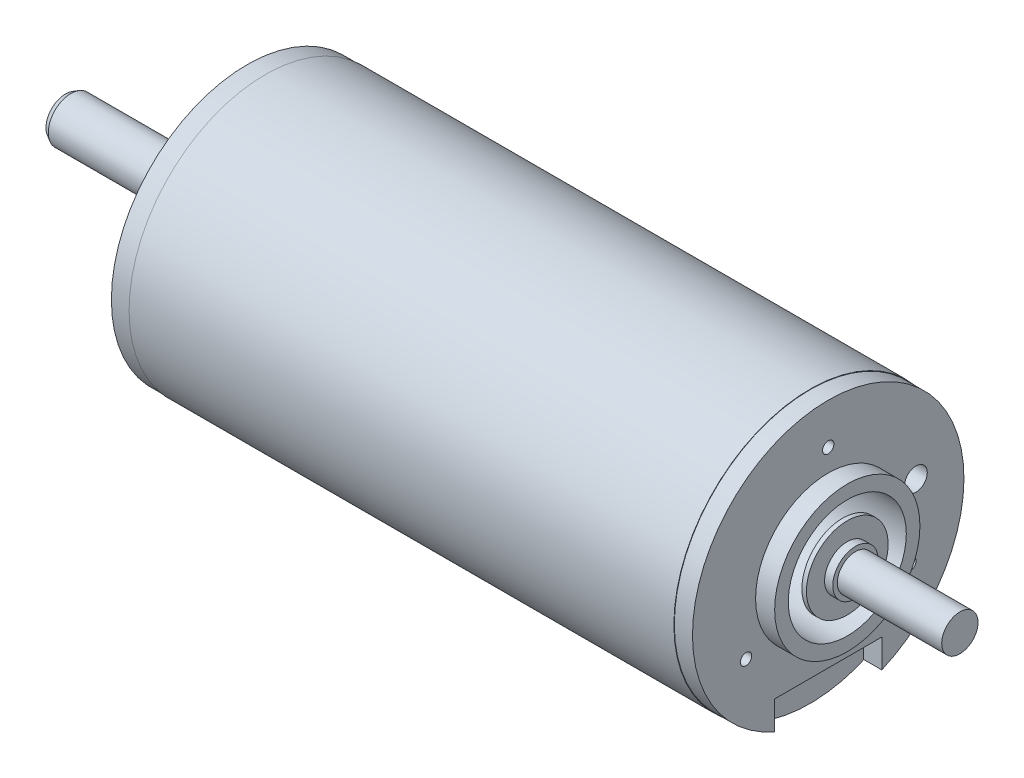
from build123d import *

# Parameters (mm, degrees)
SKETCH1_W           = 60
SKETCH1_H           = 15
BOSS_EXTRUDE1_DEPTH = 2
SKETCH3_R           = 8
BOSS_EXTRUDE2_DEPTH = 2.1
HOLE1_D             = 13
HOLE1_DEPTH         = 0.5
BOSS_EXTRUDE3_START = 2
SKETCH6_R           = 14.95
BOSS_EXTRUDE3_DEPTH = 2
BOSS_EXTRUDE4_START = 1.2
SKETCH7_R           = 8
BOSS_EXTRUDE4_DEPTH = 1.2
HOLE2_D             = 13
HOLE2_DEPTH         = 67.3
SKETCH12_W          = 1.25
SKETCH12_H          = 2
SKETCH14_W          = 1.25
SKETCH14_H          = 2
CHAMFER1_SIZE       = 0.346410161
CHAMFER1_SIZE2      = 0.6


with BuildPart() as part:
    # Sketch1 → Revolve1 (revolve)
    with BuildSketch(Plane(origin=(0, 0, 0), x_dir=(-1, 0, 0), z_dir=(0, 0, -1)), mode=Mode.PRIVATE) as revolve1_sk:
        with Locations((-32, 7.5)):
            Rectangle(SKETCH1_W, SKETCH1_H)
    revolve(revolve1_sk.sketch.rotate(Axis((62, 0, 0), (-1, 0, 0)), 270), axis=Axis((62, 0, 0), (-1, 0, 0)))

    # Sketch2 → Boss-Extrude1 (add)
    with BuildSketch(Plane(origin=(62, 0, 0), x_dir=(0, 0, -1), z_dir=(1, 0, 0))):
        with BuildLine():
            Line((5.9, -13.736538865), (5.9, -10.6))
            Line((5.9, -10.6), (-5.9, -10.6))
            Line((-5.9, -10.6), (-5.9, -13.736538865))
            ThreePointArc((-5.9, -13.736538865), (0, 14.95), (5.9, -13.736538865))
        make_face()
    extrude(amount=BOSS_EXTRUDE1_DEPTH)

    # Sketch3 → Boss-Extrude2 (add)
    with BuildSketch(Plane(origin=(64, 0, 0), x_dir=(0, 0, -1), z_dir=(1, 0, 0))):
        with Locations(Location((0, 0, 0), (0, 0, 180))):
            Circle(SKETCH3_R)
    extrude(amount=BOSS_EXTRUDE2_DEPTH)

    # Hole1
    with Locations(Plane(origin=(66.1, 0, 0), x_dir=(0, 0, -1), z_dir=(1, 0, 0))):
        with Locations((0, 0)):
            Hole(HOLE1_D / 2, depth=HOLE1_DEPTH)

    # Sketch6 → Boss-Extrude3 (add)
    with BuildSketch(Plane.ZY.offset(-2).offset(BOSS_EXTRUDE3_START)):
        Circle(SKETCH6_R)
    extrude(amount=-BOSS_EXTRUDE3_DEPTH)

    # Sketch7 → Boss-Extrude4 (add)
    with BuildSketch(Plane.ZY.offset(BOSS_EXTRUDE4_START)):
        Circle(SKETCH7_R)
    extrude(amount=-BOSS_EXTRUDE4_DEPTH)

    # Hole2
    with Locations(Plane.ZY.offset(1.2)):
        with Locations((0, 0)):
            Hole(HOLE2_D / 2, depth=HOLE2_DEPTH)

    # Sketch12 → Hole3 (revolve, cut)
    with BuildSketch(Plane(origin=(0, -5, 8.660254038), x_dir=(0, 0, 1), z_dir=(0, 1, 0))):
        with Locations((0.625, 1)):
            Rectangle(SKETCH12_W, SKETCH12_H)
    revolve(axis=Axis((110, -5, 8.660254038), (-1, 0, 0)), mode=Mode.SUBTRACT)

    # Sketch14 → Hole4 (revolve, cut)
    with BuildSketch(Plane(origin=(64, 2.588190451, -9.659258263), x_dir=(0, 0, -1), z_dir=(0, 1, 0))):
        with Locations((0.625, 1)):
            Rectangle(SKETCH14_W, SKETCH14_H)
    revolve(axis=Axis((-46, 2.588190451, -9.659258263), (1, 0, 0)), mode=Mode.SUBTRACT)

    # Sketch16 → Hole5 (revolve, cut)
    with BuildSketch(Plane(origin=(0, 0, 11), x_dir=(0, 0, 1), z_dir=(0, 1, 0))):
        Polygon((0, 0), (0, 7.251075774), (1.25, 6.5), (1.25, 0), align=None)
    revolve(axis=Axis((-4.244199587, 0, 11), (1, 0, 0)), mode=Mode.SUBTRACT)

    # Sketch18 → Hole6 (revolve, cut)
    with BuildSketch(Plane.ZX.offset(11)):
        Polygon((0, 0), (0, 7.251075774), (1.25, 6.5), (1.25, 0), align=None)
    revolve(axis=Axis((-4.244199587, 11, 0), (1, 0, 0)), mode=Mode.SUBTRACT)

    # Sketch20 → Hole7 (revolve, cut)
    with BuildSketch(Plane(origin=(0, 0, -11), x_dir=(0, 0, 1), z_dir=(0, 1, 0))):
        Polygon((0, 0), (0, 7.251075774), (1.25, 6.5), (1.25, 0), align=None)
    revolve(axis=Axis((-4.244199587, 0, -11), (1, 0, 0)), mode=Mode.SUBTRACT)

    # Sketch22 → Hole8 (revolve, cut)
    with BuildSketch(Plane.ZX.offset(-11)):
        Polygon((0, 0), (0, 7.251075774), (1.25, 6.5), (1.25, 0), align=None)
    revolve(axis=Axis((-4.244199587, -11, 0), (1, 0, 0)), mode=Mode.SUBTRACT)

    # Sketch24 → Hole9 (revolve, cut)
    with BuildSketch(Plane(origin=(64, 10.45, 0), x_dir=(0, 0, -1), z_dir=(0, 1, 0))):
        Polygon((0, 0), (0, 3.175537887), (0.625, 2.8), (0.625, 0), align=None)
    revolve(axis=Axis((68.244199587, 10.45, 0), (-1, 0, 0)), mode=Mode.SUBTRACT)

    # Sketch26 → Hole10 (revolve, cut)
    with BuildSketch(Plane(origin=(64, -5.225, -9.04996547), x_dir=(0, 0, -1), z_dir=(0, 1, 0))):
        Polygon((0, 0), (0, 3.175537887), (0.625, 2.8), (0.625, 0), align=None)
    revolve(axis=Axis((68.244199587, -5.225, -9.04996547), (-1, 0, 0)), mode=Mode.SUBTRACT)

    # Sketch28 → Hole11 (revolve, cut)
    with BuildSketch(Plane(origin=(64, -5.225, 9.04996547), x_dir=(0, 0, -1), z_dir=(0, 1, 0))):
        Polygon((0, 0), (0, 3.175537887), (0.625, 2.8), (0.625, 0), align=None)
    revolve(axis=Axis((68.244199587, -5.225, 9.04996547), (-1, 0, 0)), mode=Mode.SUBTRACT)


with BuildPart() as body_2:
    # Sketch10 → Revolve2 (revolve)
    with BuildSketch(Plane(origin=(0, 0, 0), x_dir=(-1, 0, 0), z_dir=(0, 0, -1)), mode=Mode.PRIVATE) as revolve2_sk:
        Polygon((0.7, 4.5), (0.7, 0), (20, 0), (20, 2.5), (1.2, 2.5), (1.2, 4.5), align=None)
    revolve(revolve2_sk.sketch.rotate(Axis((-0.7, 0, 0), (-1, 0, 0)), 270), axis=Axis((-0.7, 0, 0), (-1, 0, 0)))

    # Chamfer1
    chamfer1_edges = [body_2.edges().sort_by_distance(p)[0] for p in [
        (-20, 0, -2.5),
    ]]
    chamfer1_side = [body_2.faces().sort_by_distance(p)[0] for p in [
        (-20, 0, 0),
    ]]
    chamfer(chamfer1_edges, length=CHAMFER1_SIZE, length2=CHAMFER1_SIZE2, reference=chamfer1_side[0])


with BuildPart() as body_3:
    # Sketch11 → Revolve3 (revolve)
    with BuildSketch(Plane(origin=(0, 0, 0), x_dir=(-1, 0, 0), z_dir=(0, 0, -1)), mode=Mode.PRIVATE) as revolve3_sk:
        Polygon((-78.5, 2), (-78.5, 0), (-65.6, 0), (-65.6, 4.5), (-66.1, 4.5), (-66.1, 2.5), (-67, 2.5), (-67, 2), align=None)
    revolve(revolve3_sk.sketch.rotate(Axis((78.5, 0, 0), (-1, 0, 0)), 270), axis=Axis((78.5, 0, 0), (-1, 0, 0)))


solid = Compound([part.part, body_2.part, body_3.part])
